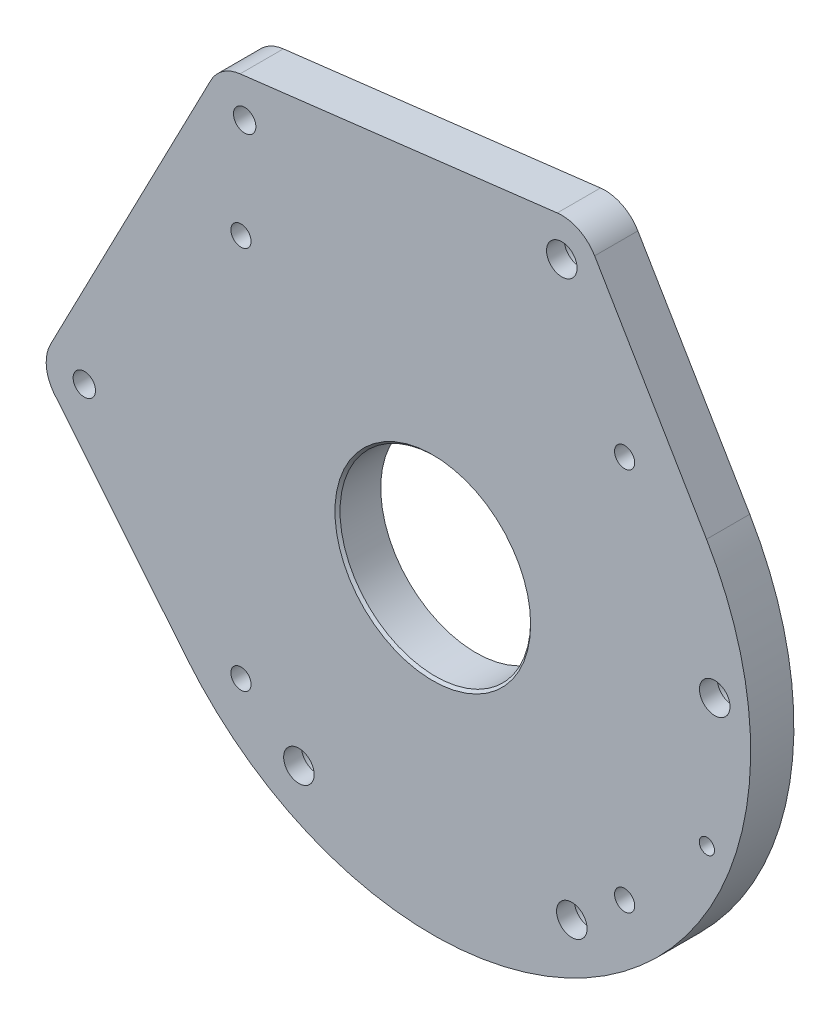
from build123d import *

# Parameters (mm, degrees)
SKETCH1_R                         = 37.475
SKETCH1_R_2                       = 4
SKETCH1_R_3                       = 6
SKETCH1_R_4                       = 1.687903887
BOSS_EXTRUDE1_DEPTH               = 17
M10X1_25_TAPPED_HOLE1_D           = 8.8
M10X1_25_TAPPED_HOLE1_ON_FACE_2_D = 8.8
F_6_0MM_DOWEL_HOLE1_D             = 6
F_3_8_16_TAPPED_HOLE1_D           = 7.9375
CHAMFER1_SIZE                     = 1
CBORE_FOR_M10_SHCS1_AT_2_COUNT    = 2
CBORE_FOR_M10_SHCS1_AT_2_PITCH    = 133.628097719
CBORE_FOR_M10_SHCS1_AT_3_COUNT    = 2
CBORE_FOR_M10_SHCS1_AT_3_PITCH    = 223.034803562
CBORE_FOR_M10_SHCS1_AT_4_COUNT    = 2
CBORE_FOR_M10_SHCS1_AT_4_PITCH    = 246.886744075


with BuildPart() as part:
    # Sketch1 → Boss-Extrude1 (new body)
    with BuildSketch(Plane.XY):
        with BuildLine():
            Line((-147.843963588, -16.38510421), (-96.939761408, -78.915668014))
            ThreePointArc((-96.939761408, -78.915668014), (71.436269945, -102.576114843), (107.636664229, 63.55586923))
            Line((107.636664229, 63.55586923), (63.646399708, 138.056704308))
            ThreePointArc((63.646399708, 138.056704308), (57.374372961, 143.878133995), (48.939902164, 145.322801944))
            Line((48.939902164, 145.322801944), (-75.770097836, 130.332801944))
            ThreePointArc((-75.770097836, 130.332801944), (-82.520736984, 127.771091264), (-87.292449774, 122.352212454))
            Line((-87.292449774, 122.352212454), (-150.342449774, 0.922212454))
            ThreePointArc((-150.342449774, 0.922212454), (-151.87610245, -8.133185025), (-147.843963588, -16.38510421))
        make_face()
        Circle(SKETCH1_R, mode=Mode.SUBTRACT)
        with Locations((-73.98, 115.44)):
            Circle(SKETCH1_R_2, mode=Mode.SUBTRACT)
        with Locations((50.73, 130.43)):
            Circle(SKETCH1_R_3, mode=Mode.SUBTRACT)
        with Locations((110.87, 11.1)):
            Circle(SKETCH1_R_3, mode=Mode.SUBTRACT)
        with Locations((107.78, -40.88)):
            Circle(SKETCH1_R_4, mode=Mode.SUBTRACT)
        with Locations((54.67, -92.57)):
            Circle(SKETCH1_R_3, mode=Mode.SUBTRACT)
        with Locations((-52.65, -93.77)):
            Circle(SKETCH1_R_3, mode=Mode.SUBTRACT)
        with Locations((-137.03, -5.99)):
            Circle(SKETCH1_R_2, mode=Mode.SUBTRACT)
    extrude(amount=BOSS_EXTRUDE1_DEPTH)

    # M10x1.25 Tapped Hole1 (through all)
    with Locations(Plane(origin=(-73.98, 115.44, 17), x_dir=(1, 0, 0), z_dir=(0, 0, 1))):
        with Locations((0, 0)):
            Hole(M10X1_25_TAPPED_HOLE1_D / 2)

    # M10x1.25 Tapped Hole1 on face 2 (through all)
    with Locations(Plane(origin=(-137.03, -5.99, 0), x_dir=(1, 0, 0), z_dir=(0, 0, 1))):
        with Locations((0, 0)):
            Hole(M10X1_25_TAPPED_HOLE1_ON_FACE_2_D / 2)

    # Ø6.0mm Dowel Hole1 (through all)
    with Locations(Plane(origin=(107.78, -40.88, 17), x_dir=(1, 0, 0), z_dir=(0, 0, 1))):
        with Locations((0, 0)):
            Hole(F_6_0MM_DOWEL_HOLE1_D / 2)

    # 3/8-16 Tapped Hole1 (through all)
    with Locations(Plane(origin=(-75.434151417, 75.434151417, 17), x_dir=(1, 0, 0), z_dir=(0, 0, 1))):
        with Locations((0, 0), (0, -150.868302834), (150.868302834, -150.868302834), (150.868302834, 0)):
            Hole(F_3_8_16_TAPPED_HOLE1_D / 2)

    # Chamfer1
    chamfer1_edges = [part.edges().sort_by_distance(p)[0] for p in [
        (-37.475, 0, 17),
    ]]
    chamfer(chamfer1_edges, length=CHAMFER1_SIZE)

    # Sketch12 → CBORE for M10 SHCS1 (revolve, cut)
    with BuildSketch(Plane(origin=(50.73, 130.43, 0), x_dir=(0, 1, 0), z_dir=(1, 0, 0))):
        Polygon((0, 0), (0, 17), (5.25, 17), (5.25, 10), (9, 10), (9, 0.025), (9.025, 0), align=None)
    cbore_for_m10_shcs1 = revolve(axis=Axis((50.73, 130.43, -6.35), (0, 0, 1)), mode=Mode.SUBTRACT)

    # CBORE for M10 SHCS1 at 2: CBORE for M10 SHCS1 ×2
    with Locations(*[Vector(0.45005504850082595, -0.8930008137280274, 0) * (i * CBORE_FOR_M10_SHCS1_AT_2_PITCH) for i in range(1, CBORE_FOR_M10_SHCS1_AT_2_COUNT)]):
        add(cbore_for_m10_shcs1, mode=Mode.SUBTRACT)

    # CBORE for M10 SHCS1 at 3: CBORE for M10 SHCS1 ×2
    with Locations(*[Vector(0.017665404399104877, -0.9998439545686197, 0) * (i * CBORE_FOR_M10_SHCS1_AT_3_PITCH) for i in range(1, CBORE_FOR_M10_SHCS1_AT_3_COUNT)]):
        add(cbore_for_m10_shcs1, mode=Mode.SUBTRACT)

    # CBORE for M10 SHCS1 at 4: CBORE for M10 SHCS1 ×2
    with Locations(*[Vector(-0.4187345107866802, -0.9081086991523866, 0) * (i * CBORE_FOR_M10_SHCS1_AT_4_PITCH) for i in range(1, CBORE_FOR_M10_SHCS1_AT_4_COUNT)]):
        add(cbore_for_m10_shcs1, mode=Mode.SUBTRACT)


solid = part.part
